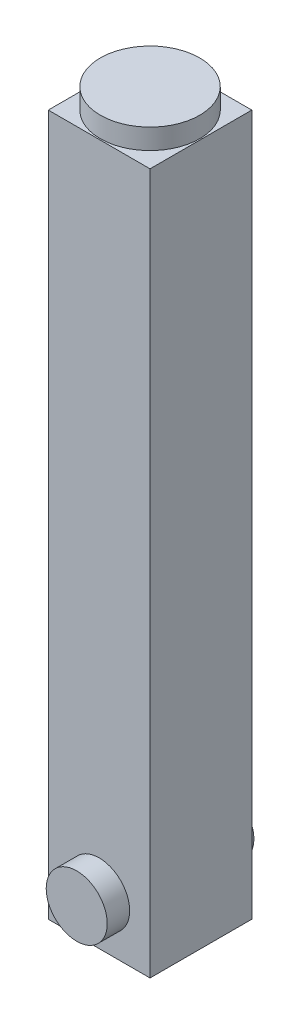
from build123d import *

# Parameters (mm, degrees)
CROQUIS2_W              = 63.5
CROQUIS2_H              = 450
SALIENTE_EXTRUIR1_DEPTH = 63.5
CROQUIS3_R              = 19.05
SALIENTE_EXTRUIR2_DEPTH = 14
SALIENTE_EXTRUIR3_START = 14
CROQUIS4_R              = 19.05
SALIENTE_EXTRUIR3_DEPTH = 14
CROQUIS5_W              = 63.5
CROQUIS5_H              = 63.5
CROQUIS5_R              = 31
CORTAR_EXTRUIR1_DEPTH   = 12.7


with BuildPart() as part:
    # Croquis2 → Saliente-Extruir1 (new body)
    with BuildSketch(Plane.XY):
        Rectangle(CROQUIS2_W, CROQUIS2_H)
    extrude(amount=SALIENTE_EXTRUIR1_DEPTH)

    # Croquis3 → Saliente-Extruir2 (add)
    with BuildSketch(Plane.XY.offset(63.5)):
        with Locations(Location((0, -195, 0), (0, 0, 180))):
            Circle(CROQUIS3_R)
    extrude(amount=SALIENTE_EXTRUIR2_DEPTH)

    # Croquis4 → Saliente-Extruir3 (add)
    with BuildSketch(Plane(origin=(0, 0, 0), x_dir=(-1, 0, 0), z_dir=(0, 0, -1)).offset(SALIENTE_EXTRUIR3_START)):
        with Locations((0, -195)):
            Circle(CROQUIS4_R)
    extrude(amount=-SALIENTE_EXTRUIR3_DEPTH)

    # Croquis5 → Cortar-Extruir1 (cut)
    with BuildSketch(Plane(origin=(0, 225, 0), x_dir=(1, 0, 0), z_dir=(0, 1, 0))):
        with Locations((0, -31.75)):
            Rectangle(CROQUIS5_W, CROQUIS5_H)
        with Locations(Location((0, -31.75, 0), (0, 0, 270))):
            Circle(CROQUIS5_R, mode=Mode.SUBTRACT)
    extrude(amount=-CORTAR_EXTRUIR1_DEPTH, mode=Mode.SUBTRACT)


solid = part.part
